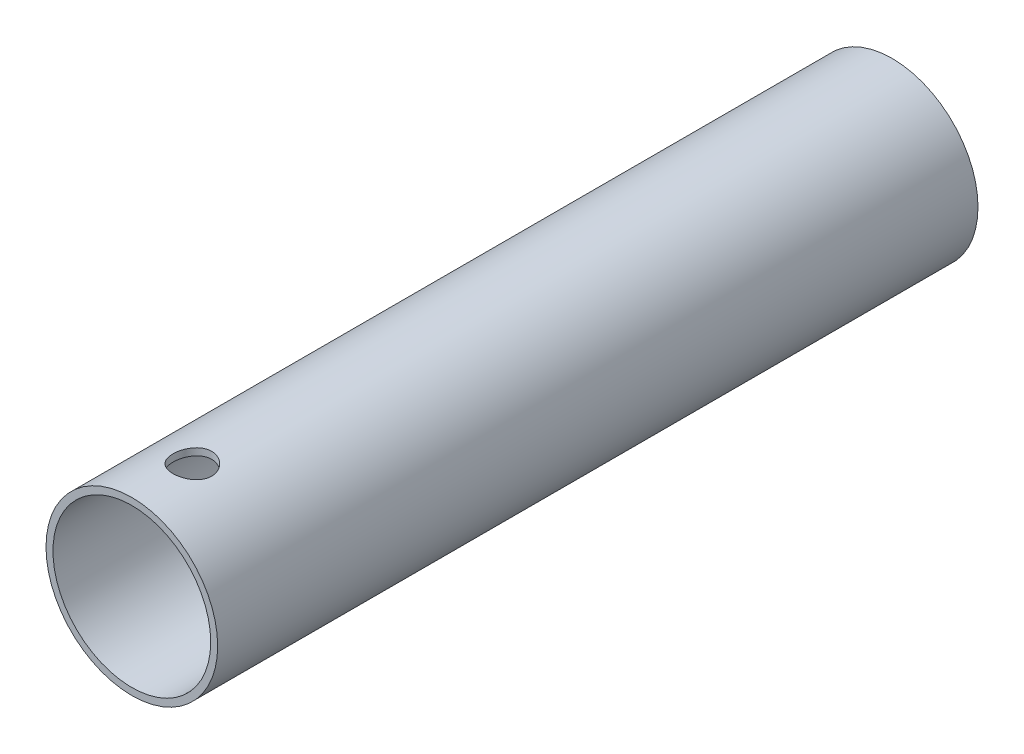
from build123d import *

# Parameters (mm, degrees)
SKETCH1_R           = 254
SKETCH1_R_2         = 233.4
BOSS_EXTRUDE1_DEPTH = 2250
SKETCH2_R           = 57.25
CUT_EXTRUDE1_DEPTH  = 2250
SKETCH3_R           = 57.25
SKETCH3_R_2         = 24.5
CUT_EXTRUDE2_DEPTH  = 2250


with BuildPart() as part:
    # Sketch1 → Boss-Extrude1 (new body)
    with BuildSketch(Plane.XY):
        Circle(SKETCH1_R)
        Circle(SKETCH1_R_2, mode=Mode.SUBTRACT)
    extrude(amount=-BOSS_EXTRUDE1_DEPTH)

    # Sketch2 → Cut-Extrude1 (cut)
    with BuildSketch(Plane(origin=(0, 0, 0), x_dir=(1, 0, 0), z_dir=(0, 1, 0))):
        with Locations(Location((0, 179, 0), (0, 0, 90))):
            Circle(SKETCH2_R)
    extrude(amount=CUT_EXTRUDE1_DEPTH, mode=Mode.SUBTRACT)

    # Sketch3 → Cut-Extrude2 (cut)
    with BuildSketch(Plane(origin=(0, 0, 0), x_dir=(1, 0, 0), z_dir=(0, 1, 0))):
        with Locations(Location((0, 2049, 0), (0, 0, 270))):
            Circle(SKETCH3_R)
        with Locations(Location((0, 649, 0), (0, 0, 270))):
            Circle(SKETCH3_R_2)
    extrude(amount=-CUT_EXTRUDE2_DEPTH, mode=Mode.SUBTRACT)


solid = part.part
